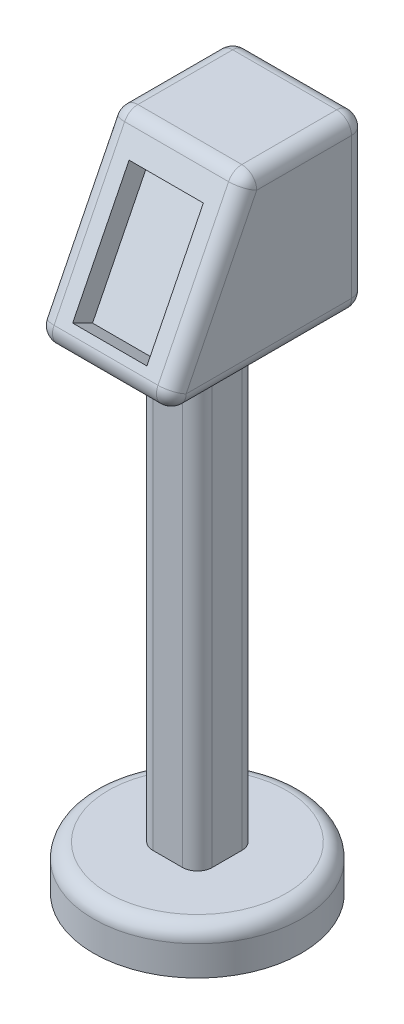
from build123d import *

# Parameters (mm, degrees)
SKETCH1_R           = 140
BOSS_EXTRUDE1_DEPTH = 60
SKETCH2_W           = 80
SKETCH2_H           = 80
BOSS_EXTRUDE2_DEPTH = 600
SKETCH3_W           = 180
SKETCH3_H           = 275
BOSS_EXTRUDE3_DEPTH = 230
CUT_EXTRUDE1_DEPTH  = 930.838695689
SKETCH5_W           = 100
SKETCH5_H           = 170
CUT_EXTRUDE2_DEPTH  = 30
SKETCH6_W           = 140
SKETCH6_H           = 210
CUT_EXTRUDE3_DEPTH  = 15
FILLET1_R           = 20
FILLET2_R           = 20
FILLET3_R           = 20


with BuildPart() as part:
    # Sketch1 → Boss-Extrude1 (new body)
    with BuildSketch(Plane(origin=(0, 0, 0), x_dir=(1, 0, 0), z_dir=(0, 1, 0))):
        with Locations(Location((0, 0, 0), (0, 0, 270))):
            Circle(SKETCH1_R)
    extrude(amount=BOSS_EXTRUDE1_DEPTH)

    # Sketch2 → Boss-Extrude2 (add)
    with BuildSketch(Plane(origin=(0, 60, 0), x_dir=(1, 0, 0), z_dir=(0, 1, 0))):
        Rectangle(SKETCH2_W, SKETCH2_H)
    extrude(amount=BOSS_EXTRUDE2_DEPTH)

    # Sketch3 → Boss-Extrude3 (add)
    with BuildSketch(Plane(origin=(0, 660, 0), x_dir=(1, 0, 0), z_dir=(0, 1, 0))):
        Rectangle(SKETCH3_W, SKETCH3_H)
    extrude(amount=BOSS_EXTRUDE3_DEPTH)

    # Sketch4 → Cut-Extrude1 (cut, through all)
    with BuildSketch(Plane.ZY.offset(90)):
        Polygon((22.5, 890), (137.5, 660), (137.5, 890), align=None)
    extrude(amount=-CUT_EXTRUDE1_DEPTH, mode=Mode.SUBTRACT)

    # Sketch5 → Cut-Extrude2 (cut)
    with BuildSketch(Plane(origin=(0, 187, 374), x_dir=(1, 0, 0), z_dir=(0, 0.4472135954999582, 0.8944271909999159))):
        with Locations((0, 657.427894091)):
            Rectangle(SKETCH5_W, SKETCH5_H)
    extrude(amount=-CUT_EXTRUDE2_DEPTH, mode=Mode.SUBTRACT)

    # Sketch6 → Cut-Extrude3 (cut)
    with BuildSketch(Plane(origin=(0, 173.583592135, 347.16718427), x_dir=(1, 0, 0), z_dir=(0, 0.44721359549995826, 0.8944271909999159))):
        with Locations((0, 657.427894091)):
            Rectangle(SKETCH6_W, SKETCH6_H)
    extrude(amount=-CUT_EXTRUDE3_DEPTH, mode=Mode.SUBTRACT)

    # Fillet1
    fillet1_edges = [part.edges().sort_by_distance(p)[0] for p in [
        (0, 60, -140),
        (40, 360, 40),
        (40, 360, -40),
        (-40, 360, -40),
    ]]
    fillet(fillet1_edges, radius=FILLET1_R)

    # Fillet2
    fillet2_edges = [part.edges().sort_by_distance(p)[0] for p in [
        (-40, 360, 40),
    ]]
    fillet(fillet2_edges, radius=FILLET2_R)

    # Fillet3
    fillet3_edges = [part.edges().sort_by_distance(p)[0] for p in [
        (90, 660, 0),
        (0, 660, -137.5),
        (90, 775, -137.5),
        (-90, 660, 0),
        (-90, 775, -137.5),
        (0, 660, 137.5),
        (0, 890, -137.5),
        (-90, 890, -57.5),
        (90, 890, -57.5),
        (0, 890, 22.5),
        (90, 775, 80),
        (-90, 775, 80),
    ]]
    fillet(fillet3_edges, radius=FILLET3_R)


solid = part.part
